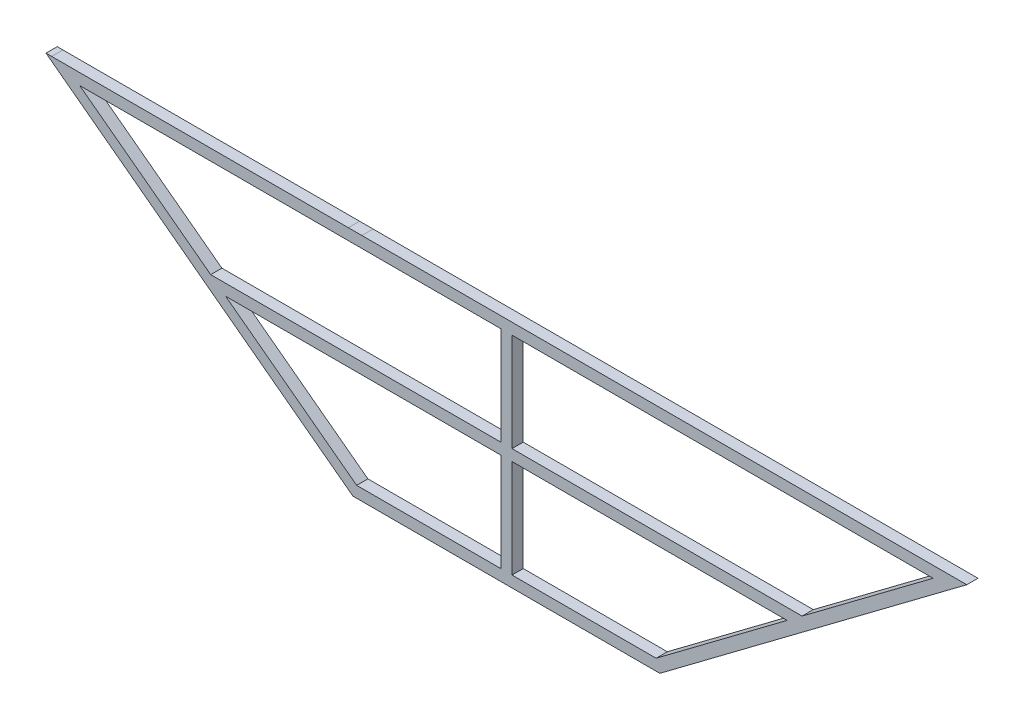
from build123d import *

# Parameters (mm, degrees)
BOSS_EXTRUDE2_DEPTH = 14.63


with BuildPart() as part:
    # Sketch1 → Boss-Extrude2 (new body)
    with BuildSketch(Plane.XY):
        Polygon((0, 0), (-400, 0), (-800, 300), (400, 300), align=None)
        Polygon((-585.37, 157.315), (-756.11, 285.37), (-207.315, 285.37), (-207.315, 157.315), (-575.616666667, 157.315), align=None, mode=Mode.SUBTRACT)
        Polygon((-565.863333333, 142.685), (-207.315, 142.685), (-207.315, 14.63), (-395.123333333, 14.63), align=None, mode=Mode.SUBTRACT)
        Polygon((356.11, 285.37), (185.37, 157.315), (175.161951027, 157.315), (-192.685, 157.315), (-192.685, 285.37), align=None, mode=Mode.SUBTRACT)
        Polygon((-4.876666667, 14.63), (-192.685, 14.63), (-192.685, 142.685), (165.863333333, 142.685), align=None, mode=Mode.SUBTRACT)
    extrude(amount=BOSS_EXTRUDE2_DEPTH)


solid = part.part
